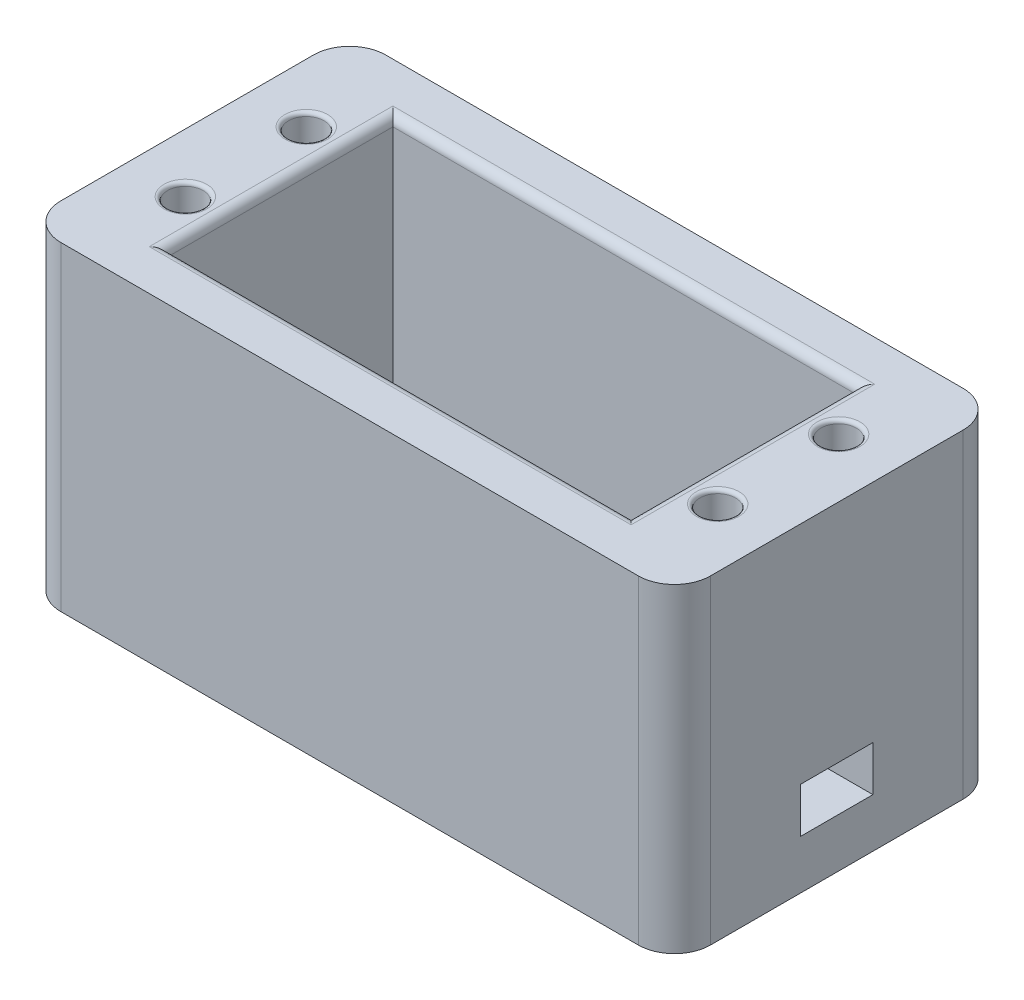
from build123d import *

# Parameters (mm, degrees)
SKETCH1_W           = 91.44
SKETCH1_H           = 45.72
BOSS_EXTRUDE1_DEPTH = 45
SKETCH2_W           = 65.278
SKETCH2_H           = 31.75
CUT_EXTRUDE1_DEPTH  = 40
SKETCH3_R           = 2.5
CUT_EXTRUDE2_DEPTH  = 25.4
FILLET1_R           = 5.08
FILLET3_R           = 1.27
FILLET4_R           = 0.508
SKETCH4_W           = 10.16
SKETCH4_H           = 6.35
CUT_EXTRUDE3_DEPTH  = 94.207899241


with BuildPart() as part:
    # Sketch1 → Boss-Extrude1 (new body)
    with BuildSketch(Plane(origin=(0, 0, 0), x_dir=(1, 0, 0), z_dir=(0, 1, 0))):
        Rectangle(SKETCH1_W, SKETCH1_H)
    extrude(amount=BOSS_EXTRUDE1_DEPTH)

    # Sketch2 → Cut-Extrude1 (cut)
    with BuildSketch(Plane(origin=(0, 45, 0), x_dir=(1, 0, 0), z_dir=(0, 1, 0))):
        Rectangle(SKETCH2_W, SKETCH2_H)
    extrude(amount=-CUT_EXTRUDE1_DEPTH, mode=Mode.SUBTRACT)

    # Sketch3 → Cut-Extrude2 (cut)
    with BuildSketch(Plane(origin=(0, 45, 0), x_dir=(1, 0, 0), z_dir=(0, 1, 0))):
        with Locations(Location((37.465, 8.509, 0), (0, 0, 270))):
            Circle(SKETCH3_R)
        with Locations(Location((37.465, -8.509, 0), (0, 0, 270))):
            Circle(SKETCH3_R)
        with Locations(Location((-37.465, -8.509, 0), (0, 0, 90))):
            Circle(SKETCH3_R)
        with Locations(Location((-37.465, 8.509, 0), (0, 0, 90))):
            Circle(SKETCH3_R)
    extrude(amount=-CUT_EXTRUDE2_DEPTH, mode=Mode.SUBTRACT)

    # Fillet1
    fillet1_edges = [part.edges().sort_by_distance(p)[0] for p in [
        (45.72, 22.5, 22.86),
        (-45.72, 22.5, 22.86),
        (-45.72, 22.5, -22.86),
        (45.72, 22.5, -22.86),
    ]]
    fillet(fillet1_edges, radius=FILLET1_R)

    # Fillet3
    fillet3_edges = [part.edges().sort_by_distance(p)[0] for p in [
        (32.639, 45, 0),
        (0, 45, -15.875),
        (-32.639, 45, 0),
        (0, 45, 15.875),
    ]]
    fillet(fillet3_edges, radius=FILLET3_R)

    # Fillet4
    fillet4_edges = [part.edges().sort_by_distance(p)[0] for p in [
        (-37.465, 45, -6.009),
        (-37.465, 45, 11.009),
        (37.465, 45, 6.009),
        (37.465, 45, -11.009),
    ]]
    fillet(fillet4_edges, radius=FILLET4_R)

    # Sketch4 → Cut-Extrude3 (cut, through all)
    with BuildSketch(Plane.ZY.offset(-32.639)):
        with Locations((0, 10.08)):
            Rectangle(SKETCH4_W, SKETCH4_H)
    extrude(amount=-CUT_EXTRUDE3_DEPTH, mode=Mode.SUBTRACT)


solid = part.part
